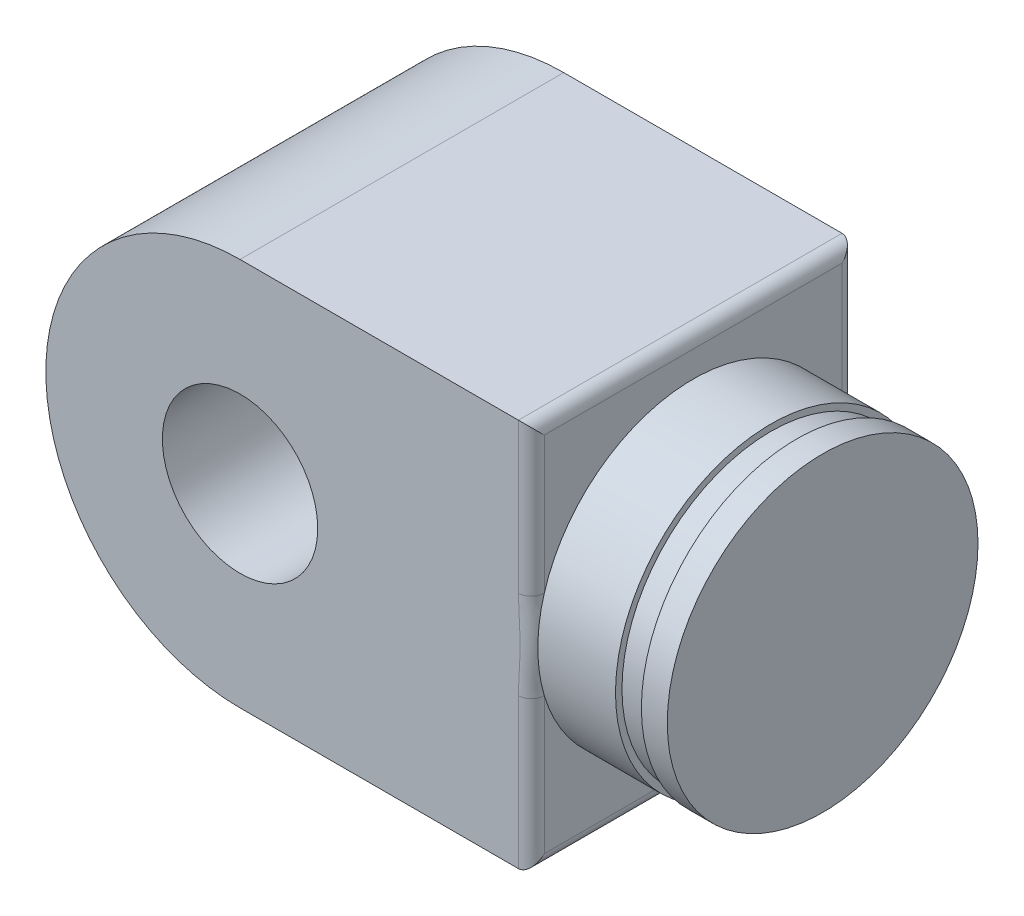
from build123d import *

# Parameters (mm, degrees)
BOSS_EXTRU_1_DEPTH      = 25
ESQUISSE2_R             = 12
ENL_V_MAT_EXTRU_1_DEPTH = 74.654599313
ESQUISSE3_R             = 24
BOSS_EXTRU_2_DEPTH      = 20
ESQUISSE4_R             = 24.5
ESQUISSE4_R_2           = 23
ENL_V_MAT_EXTRU_2_DEPTH = 4
CONG_1_R                = 2


with BuildPart() as part:
    # Esquisse1 → Boss.-Extru.1 (new, symmetric)
    with BuildSketch(Plane.XY):
        with BuildLine():
            Line((0, -30), (45, -30))
            Line((45, -30), (45, 30))
            Line((45, 30), (0, 30))
            ThreePointArc((0, 30), (-30, 0), (0, -30))
        make_face()
    extrude(amount=BOSS_EXTRU_1_DEPTH, both=True)

    # Esquisse2 → Enlèv. mat.-Extru.1 (cut, through all)
    with BuildSketch(Plane.XY.offset(25)):
        Circle(ESQUISSE2_R)
    extrude(amount=-ENL_V_MAT_EXTRU_1_DEPTH, mode=Mode.SUBTRACT)

    # Esquisse3 → Boss.-Extru.2 (add)
    with BuildSketch(Plane(origin=(45, 0, 0), x_dir=(0, 0, -1), z_dir=(1, 0, 0))):
        Circle(ESQUISSE3_R)
    extrude(amount=BOSS_EXTRU_2_DEPTH)

    # Esquisse4 → Enlèv. mat.-Extru.2 (cut)
    with BuildSketch(Plane(origin=(61, 0, 0), x_dir=(0, 0, -1), z_dir=(1, 0, 0))):
        Circle(ESQUISSE4_R)
        Circle(ESQUISSE4_R_2, mode=Mode.SUBTRACT)
    extrude(amount=-ENL_V_MAT_EXTRU_2_DEPTH, mode=Mode.SUBTRACT)

    # Congé1
    cong_1_edges = [part.edges().sort_by_distance(p)[0] for p in [
        (45, 0, -25),
        (45, 0, 25),
        (45, 30, 0),
        (45, -30, 0),
    ]]
    fillet(cong_1_edges, radius=CONG_1_R)


solid = part.part
